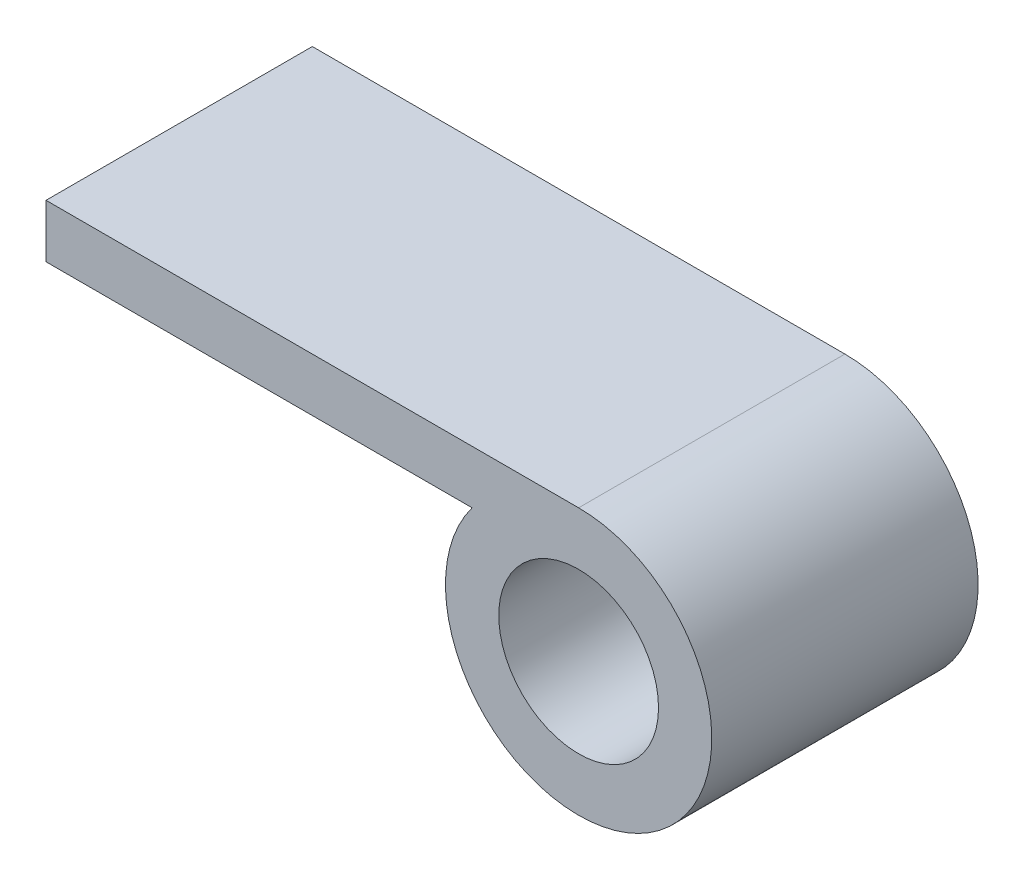
from build123d import *

# Parameters (mm, degrees)
SKETCH1_R           = 3
BOSS_EXTRUDE1_DEPTH = 10


with BuildPart() as part:
    # Sketch1 → Boss-Extrude1 (new body)
    with BuildSketch(Plane.XY):
        with BuildLine():
            Line((0, 5), (-20, 5))
            Line((-20, 5), (-20, 3))
            Line((-20, 3), (-4, 3))
            ThreePointArc((-4, 3), (2.236067977, -4.472135955), (0, 5))
        make_face()
        Circle(SKETCH1_R, mode=Mode.SUBTRACT)
    extrude(amount=BOSS_EXTRUDE1_DEPTH)


solid = part.part
